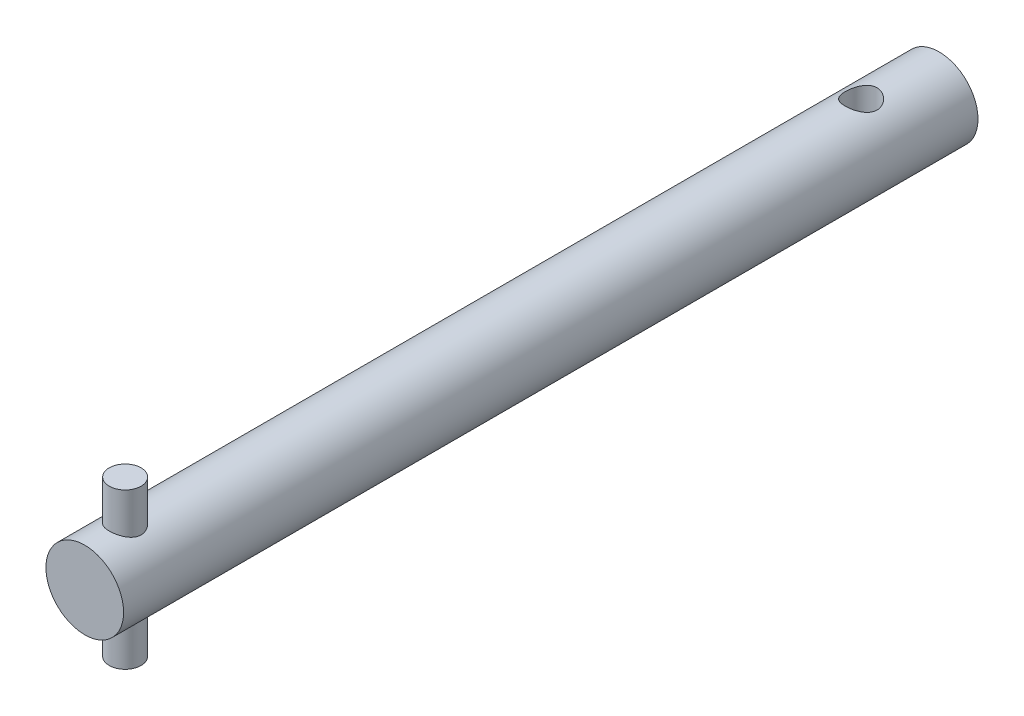
from build123d import *

# Parameters (mm, degrees)
SKETCH_1_R               = 10
EXTRUDE_1_DEPTH          = 220
CUT_EXTRUDE_1_DEPTH      = 221.45407685
CUT_EXTRUDE_1_DEPTH_BACK = 221.45407685
SKETCH_2_R               = 4.1
EXTRUDE_2_DEPTH          = 20
EXTRUDE_2_DEPTH_BACK     = 20
SKETCH_3_R               = 4.1


with BuildPart() as part:
    # Эскиз1 → Бобышка-Вытянуть1 (new body)
    with BuildSketch(Plane.XY):
        Circle(SKETCH_1_R)
    extrude(amount=EXTRUDE_1_DEPTH)

    # Эскиз2 → Вырез-Вытянуть1 (cut, two sides: drawn at the far end of the back side and taken through both)
    with BuildSketch(Plane(origin=(0, 0, 0), x_dir=(1, 0, 0), z_dir=(0, 1, 0)).offset(-CUT_EXTRUDE_1_DEPTH_BACK)):
        with Locations((0, -20.1)):
            Circle(SKETCH_2_R)
        with Locations((0, -209.6)):
            Circle(SKETCH_2_R)
    extrude(amount=CUT_EXTRUDE_1_DEPTH + CUT_EXTRUDE_1_DEPTH_BACK, mode=Mode.SUBTRACT)


with BuildPart() as body_2:
    # Эскиз3 → Бобышка-Вытянуть2 (new, two sides: drawn at the far end of the back side and taken through both)
    with BuildSketch(Plane(origin=(0, 0, 0), x_dir=(1, 0, 0), z_dir=(0, 1, 0)).offset(-EXTRUDE_2_DEPTH_BACK)):
        with Locations((0, -209.6)):
            Circle(SKETCH_3_R)
    extrude(amount=EXTRUDE_2_DEPTH + EXTRUDE_2_DEPTH_BACK)


solid = Compound([part.part, body_2.part])
